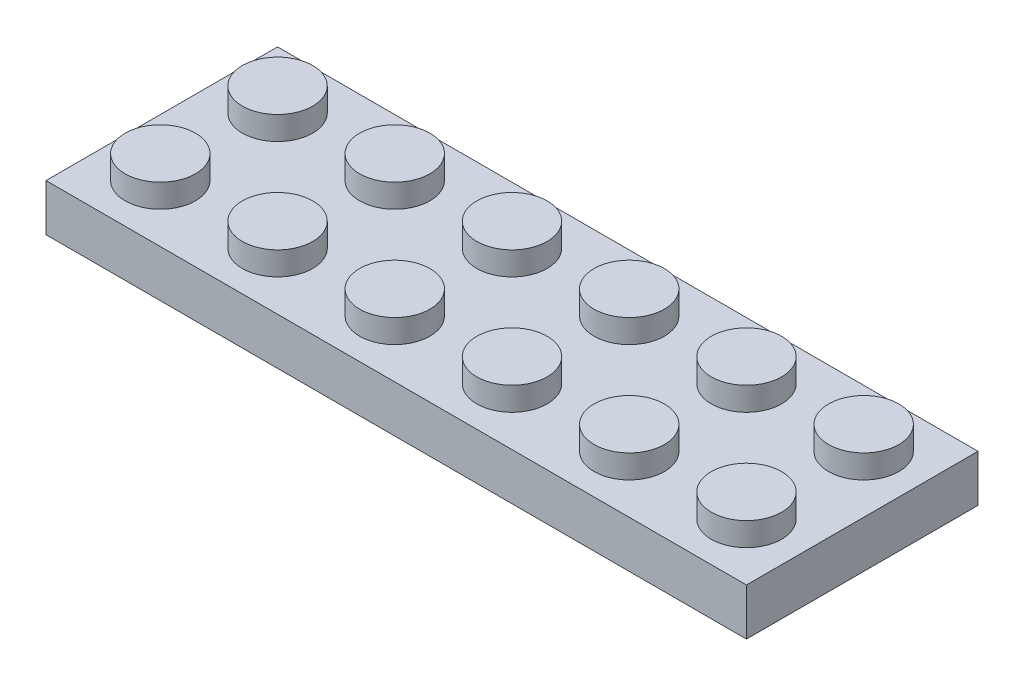
from build123d import *

# Parameters (mm, degrees)
SKETCH1_W            = 47.8
SKETCH1_H            = 3.2
BOSS_EXTRUDE1_DEPTH  = 15.8
SKETCH2_R            = 2.4
BOSS_EXTRUDE2_DEPTH  = 1.6
LPATTERN1_COUNT      = 2
LPATTERN1_PITCH      = 8
LPATTERN1_COUNT_DIR2 = 6
LPATTERN1_PITCH_DIR2 = 8
SHELL1_T             = -1.2
SKETCH3_R            = 3.25
SKETCH3_R_2          = 2.4
BOSS_EXTRUDE3_DEPTH  = 1.8
LPATTERN2_COUNT      = 5
LPATTERN2_PITCH      = 8


with BuildPart() as part:
    # Sketch1 → Boss-Extrude1 (new body)
    with BuildSketch(Plane.XY):
        with Locations((23.9, 1.6)):
            Rectangle(SKETCH1_W, SKETCH1_H)
    extrude(amount=-BOSS_EXTRUDE1_DEPTH)

    # Sketch2 → Boss-Extrude2 (add)
    with BuildSketch(Plane(origin=(0, 3.2, 0), x_dir=(1, 0, 0), z_dir=(0, 1, 0))):
        with Locations(Location((3.9, 3.9, 0), (0, 0, 270))):
            Circle(SKETCH2_R)
    boss_extrude2 = extrude(amount=BOSS_EXTRUDE2_DEPTH)

    # LPattern1: Boss-Extrude2 2 × 6
    with Locations(*[(j * LPATTERN1_PITCH_DIR2, 0, -i * LPATTERN1_PITCH) for i in range(LPATTERN1_COUNT) for j in range(LPATTERN1_COUNT_DIR2) if (i, j) != (0, 0)]):
        add(boss_extrude2)

    # Shell1
    shell1_openings = [part.faces().sort_by_distance(p)[0] for p in [
        (23.9, 0, -7.9),
    ]]
    offset(amount=SHELL1_T, openings=shell1_openings, kind=Kind.INTERSECTION)

    # Sketch3 → Boss-Extrude3 (add)
    with BuildSketch(Plane.XZ.offset(-2)):
        with Locations(Location((7.9, -7.9, 0), (0, 0, 90))):
            Circle(SKETCH3_R)
        with Locations(Location((7.9, -7.9, 0), (0, 0, 270))):
            Circle(SKETCH3_R_2, mode=Mode.SUBTRACT)
    boss_extrude3 = extrude(amount=BOSS_EXTRUDE3_DEPTH)

    # LPattern2: Boss-Extrude3 ×5
    with Locations(*[(i * LPATTERN2_PITCH, 0, 0) for i in range(1, LPATTERN2_COUNT)]):
        add(boss_extrude3)


solid = part.part
